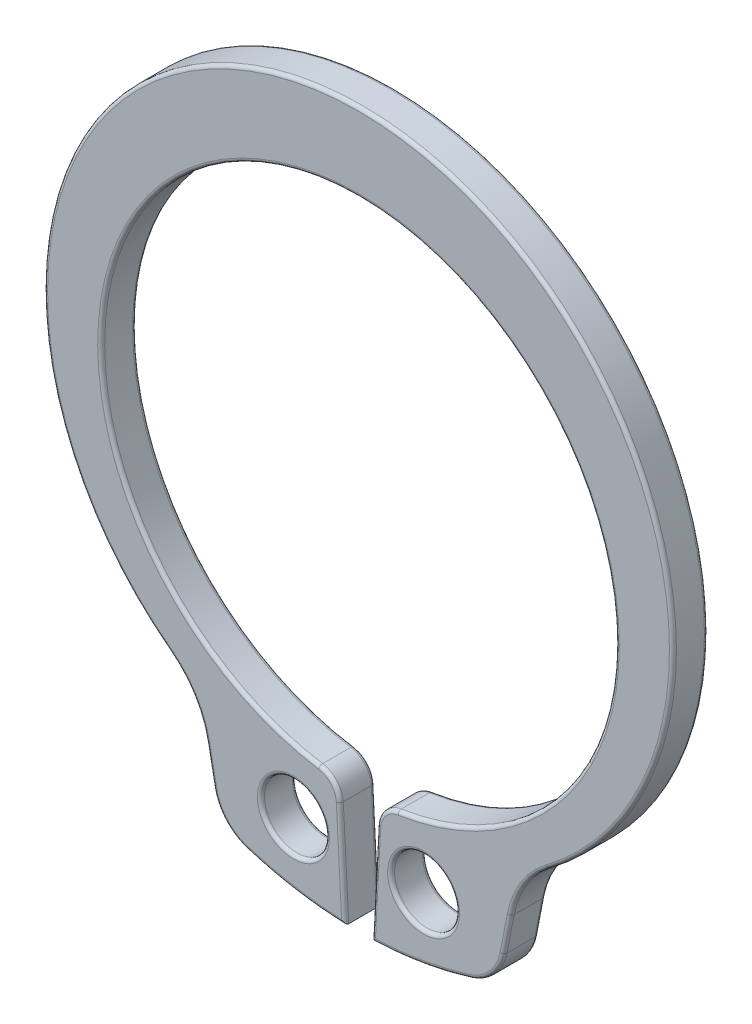
from build123d import *

# Parameters (mm, degrees)
SKETCH2_R           = 0.927
BOSS_EXTRUDE1_DEPTH = 0.5
FILLET1_R           = 2.787374056
FILLET2_R           = 1.393687028
FILLET3_R           = 0.696843514
FILLET4_R           = 0.1


with BuildPart() as part:
    # Sketch2 → Boss-Extrude1 (new, symmetric)
    with BuildSketch(Plane.XY):
        with BuildLine():
            Line((-3.9913688, -10.101667701), (-4.567334288, -7.130078103))
            ThreePointArc((-4.567334288, -7.130078103), (-8.663924897, 2.97084317), (0, 9.585))
            Line((0, 9.585), (0, 7.35))
            ThreePointArc((0, 7.35), (-7.344582346, 0.282152728), (-0.56388951, -7.328337371))
            Line((-0.56388951, -7.328337371), (-0.379064953, -10.855))
            ThreePointArc((-0.379064953, -10.855), (-2.217442262, -10.632857803), (-3.9913688, -10.101667701))
        make_face()
        with Locations((-1.858987009, -8.91402895)):
            Circle(SKETCH2_R, mode=Mode.SUBTRACT)
    extrude(amount=BOSS_EXTRUDE1_DEPTH, both=True)

    # Fillet1
    fillet1_edges = [part.edges().sort_by_distance(p)[0] for p in [
        (-4.567334288, -7.130078103, 0),
    ]]
    fillet(fillet1_edges, radius=FILLET1_R)

    # Fillet2
    fillet2_edges = [part.edges().sort_by_distance(p)[0] for p in [
        (-3.9913688, -10.101667701, 0),
    ]]
    fillet(fillet2_edges, radius=FILLET2_R)

    # Fillet3
    fillet3_edges = [part.edges().sort_by_distance(p)[0] for p in [
        (-0.56388951, -7.328337371, 0),
    ]]
    fillet(fillet3_edges, radius=FILLET3_R)

    # Mirror1: part across plane


with BuildPart() as part_1:
    add(part.part)
    add(part.part.mirror(Plane(origin=(0, 9.585, 0.5), x_dir=(0, 0, 1), z_dir=(-1, 0, 0))))

    # Fillet4
    fillet4_edges = [part_1.edges().sort_by_distance(p)[0] for p in [
        (-0.456078981, -9.385484794, 0.5),
        (-2.785987009, -8.91402895, -0.5),
        (-2.785987009, -8.91402895, 0.5),
        (-4.245449296, -8.790785411, -0.5),
        (-4.245449296, -8.790785411, 0.5),
        (-4.719621728, -7.318395535, -0.5),
        (-4.719621728, -7.318395535, 0.5),
        (-1.796840548, -10.711959638, -0.5),
        (-1.796840548, -10.711959638, 0.5),
        (-3.811503464, -9.983954028, -0.5),
        (-3.811503464, -9.983954028, 0.5),
        (7.328411112, 0.56293034, -0.5),
        (0, 7.35, 0.5),
        (-0.712001326, -7.485189778, -0.5),
        (-0.712001326, -7.485189778, 0.5),
        (8.517222912, 3.453900117, 0.5),
        (2.785987009, -8.91402895, 0.5),
        (4.245449296, -8.790785411, -0.5),
        (1.796840548, -10.711959638, -0.5),
        (0.456078981, -9.385484794, -0.5),
        (4.245449296, -8.790785411, 0.5),
        (1.796840548, -10.711959638, 0.5),
        (0.456078981, -9.385484794, 0.5),
        (2.785987009, -8.91402895, -0.5),
        (4.719621728, -7.318395535, 0.5),
        (4.719621728, -7.318395535, -0.5),
        (3.811503464, -9.983954028, 0.5),
        (3.811503464, -9.983954028, -0.5),
        (0.712001326, -7.485189778, 0.5),
        (0.712001326, -7.485189778, -0.5),
        (-0.456078981, -9.385484794, -0.5),
        (8.517222912, 3.453900117, -0.5),
    ]]
    fillet(fillet4_edges, radius=FILLET4_R)


solid = part_1.part
